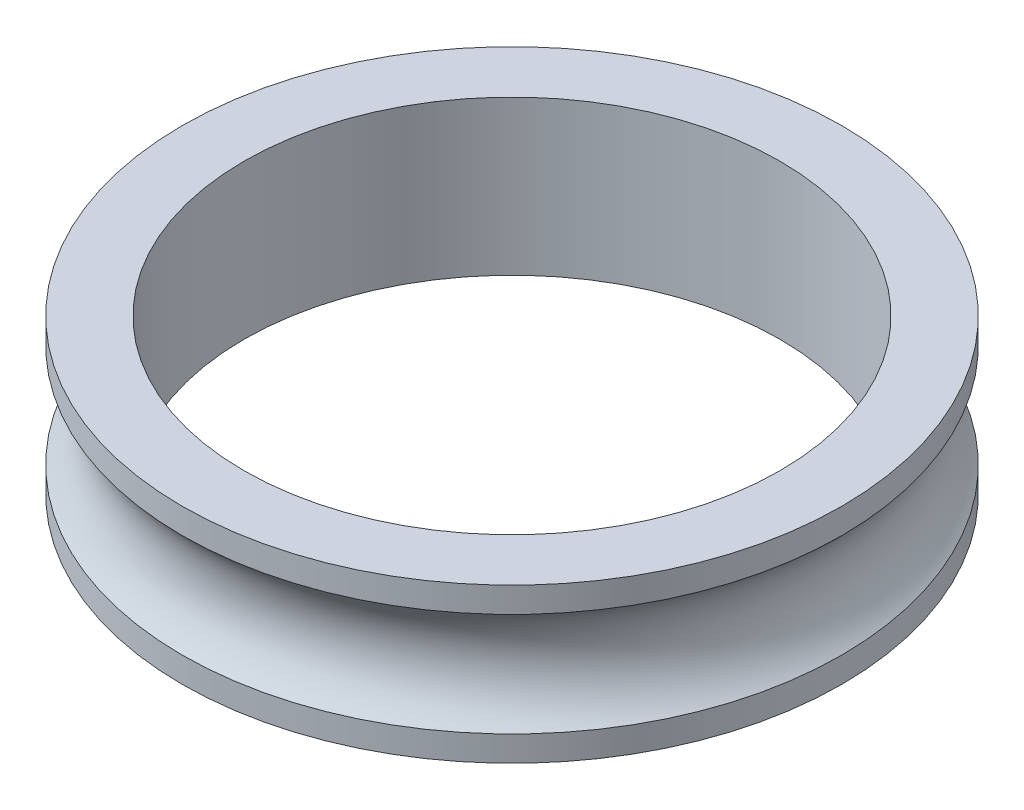
from build123d import *


with BuildPart() as part:
    # 草图1 → 旋转1 (revolve)
    with BuildSketch(Plane.XY, mode=Mode.PRIVATE) as revolve_1_sk:
        with BuildLine():
            Line((34.75, 10), (34.75, -10))
            Line((34.75, -10), (42.75, -10))
            Line((42.75, -10), (42.75, -6.708203932))
            ThreePointArc((42.75, -6.708203932), (39.75, 0), (42.75, 6.708203932))
            Line((42.75, 6.708203932), (42.75, 10))
            Line((42.75, 10), (34.75, 10))
        make_face()
    revolve(revolve_1_sk.sketch.rotate(Axis((0, 53.374213025, 0), (0, -1, 0)), 90), axis=Axis((0, 53.374213025, 0), (0, -1, 0)))


solid = part.part
